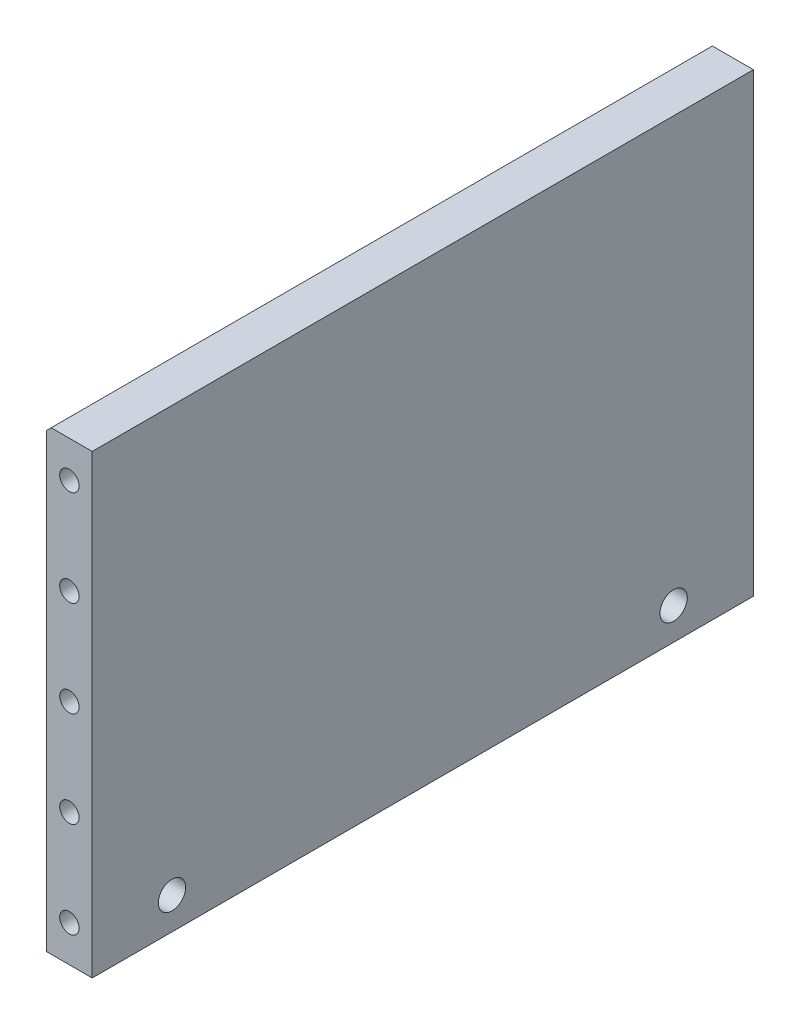
from build123d import *

# Parameters (mm, degrees)
SCHIZZO1_W                  = 290
SCHIZZO1_H                  = 200
ESTRUSIONE1_DEPTH           = 20
M10_TAPPED_HOLE1_AT_2_COUNT = 2
M10_TAPPED_HOLE1_AT_2_PITCH = 168
M10_TAPPED_HOLE1_AT_3_COUNT = 2
M10_TAPPED_HOLE1_AT_3_PITCH = 126
M10_TAPPED_HOLE1_AT_4_COUNT = 2
M10_TAPPED_HOLE1_AT_4_PITCH = 42
M10_TAPPED_HOLE1_AT_5_COUNT = 2
M10_TAPPED_HOLE1_AT_5_PITCH = 84
M14_TAPPED_HOLE1_D          = 12
M14_TAPPED_HOLE1_DEPTH      = 38
M14_TAPPED_HOLE1_TIP        = 3.605163714
SMUSSO1_SIZE                = 2


with BuildPart() as part:
    # Schizzo1 → Estrusione1 (new body)
    with BuildSketch(Plane(origin=(0, 0, 0), x_dir=(0, 0, -1), z_dir=(1, 0, 0))):
        with Locations((145, 100)):
            Rectangle(SCHIZZO1_W, SCHIZZO1_H)
    extrude(amount=ESTRUSIONE1_DEPTH)

    # Schizzo2 → M10 Tapped Hole1 (revolve, cut)
    with BuildSketch(Plane(origin=(10, 184, 0), x_dir=(0, -1, 0), z_dir=(1, 0, 0))):
        Polygon((0, 0), (0, 30.053657631), (4.25, 27.5), (4.25, 0), align=None)
    m10_tapped_hole1 = revolve(axis=Axis((10, 184, 6.35), (0, 0, -1)), mode=Mode.SUBTRACT)

    # M10 Tapped Hole1 at 2: M10 Tapped Hole1 ×2
    with Locations(*[(0, -i * M10_TAPPED_HOLE1_AT_2_PITCH, 0) for i in range(1, M10_TAPPED_HOLE1_AT_2_COUNT)]):
        add(m10_tapped_hole1, mode=Mode.SUBTRACT)

    # M10 Tapped Hole1 at 3: M10 Tapped Hole1 ×2
    with Locations(*[(0, -i * M10_TAPPED_HOLE1_AT_3_PITCH, 0) for i in range(1, M10_TAPPED_HOLE1_AT_3_COUNT)]):
        add(m10_tapped_hole1, mode=Mode.SUBTRACT)

    # M10 Tapped Hole1 at 4: M10 Tapped Hole1 ×2
    with Locations(*[(0, -i * M10_TAPPED_HOLE1_AT_4_PITCH, 0) for i in range(1, M10_TAPPED_HOLE1_AT_4_COUNT)]):
        add(m10_tapped_hole1, mode=Mode.SUBTRACT)

    # M10 Tapped Hole1 at 5: M10 Tapped Hole1 ×2
    with Locations(*[(0, -i * M10_TAPPED_HOLE1_AT_5_PITCH, 0) for i in range(1, M10_TAPPED_HOLE1_AT_5_COUNT)]):
        add(m10_tapped_hole1, mode=Mode.SUBTRACT)

    # Specchia1: M10 Tapped Hole1 across plane
    add(m10_tapped_hole1.mirror(Plane.XY.offset(-145)), mode=Mode.SUBTRACT)

    # Specchia1 copy 1 sketch → Specchia1 copy 1 (revolve, cut)
    with BuildSketch(Plane(origin=(10, 16, -290), x_dir=(0, -1, 0), z_dir=(1, 0, 0))):
        Polygon((0, 0), (0, -30.053657631), (4.25, -27.5), (4.25, 0), align=None)
    revolve(axis=Axis((10, 16, -296.35), (0, 0, -1)), mode=Mode.SUBTRACT)

    # Specchia1 copy 2 sketch → Specchia1 copy 2 (revolve, cut)
    with BuildSketch(Plane(origin=(10, 58, -290), x_dir=(0, -1, 0), z_dir=(1, 0, 0))):
        Polygon((0, 0), (0, -30.053657631), (4.25, -27.5), (4.25, 0), align=None)
    revolve(axis=Axis((10, 58, -296.35), (0, 0, -1)), mode=Mode.SUBTRACT)

    # Specchia1 copy 3 sketch → Specchia1 copy 3 (revolve, cut)
    with BuildSketch(Plane(origin=(10, 142, -290), x_dir=(0, -1, 0), z_dir=(1, 0, 0))):
        Polygon((0, 0), (0, -30.053657631), (4.25, -27.5), (4.25, 0), align=None)
    revolve(axis=Axis((10, 142, -296.35), (0, 0, -1)), mode=Mode.SUBTRACT)

    # Specchia1 copy 4 sketch → Specchia1 copy 4 (revolve, cut)
    with BuildSketch(Plane(origin=(10, 100, -290), x_dir=(0, -1, 0), z_dir=(1, 0, 0))):
        Polygon((0, 0), (0, -30.053657631), (4.25, -27.5), (4.25, 0), align=None)
    revolve(axis=Axis((10, 100, -296.35), (0, 0, -1)), mode=Mode.SUBTRACT)

    # M14 Tapped Hole1
    with Locations(Plane(origin=(20, 0, 0), x_dir=(0, 0, -1), z_dir=(1, 0, 0))):
        with Locations((35, 14), (255, 14)):
            Hole(M14_TAPPED_HOLE1_D / 2, depth=M14_TAPPED_HOLE1_DEPTH)
            with Locations((0, 0, -(M14_TAPPED_HOLE1_DEPTH + M14_TAPPED_HOLE1_TIP / 2))):  # 118° drill point
                Cone(0, M14_TAPPED_HOLE1_D / 2, M14_TAPPED_HOLE1_TIP, mode=Mode.SUBTRACT)

    # Smusso1
    smusso1_edges = [part.edges().sort_by_distance(p)[0] for p in [
        (0, 200, -145),
    ]]
    chamfer(smusso1_edges, length=SMUSSO1_SIZE)


solid = part.part
